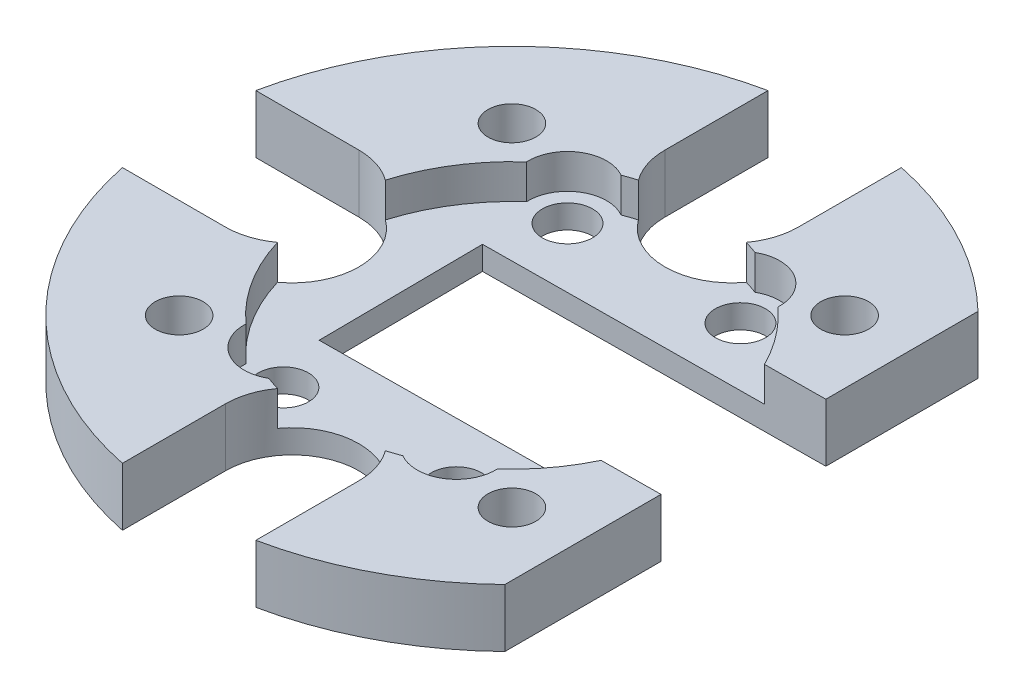
from build123d import *

# Parameters (mm, degrees)
SKETCH_1_R                      = 21
EXTRUDE_1_DEPTH                 = 1.5
SKETCH_2_R                      = 21
SKETCH_2_R_2                    = 12
EXTRUDE_2_DEPTH                 = 2.2
SKETCH_7_R                      = 1.25
CUT_EXTRUDE_5_DEPTH             = 30.92808046
SKETCH_8_W                      = 14.034551426
SKETCH_8_H                      = 10.5
CUT_EXTRUDE_6_DEPTH             = 30.92808046
SKETCH_9_W                      = 17.42220177
SKETCH_9_H                      = 10.5
CUT_EXTRUDE_7_DEPTH             = 30.92808046
MOVE_BODY_5_ANGLE               = 45
MOVE_BODY_6_ANGLE               = 5
SKETCH_15_R                     = 0.55
SKETCH_15_R_2                   = 0.5
CUT_EXTRUDE_9_DEPTH             = 30.92808046
MOVE_BODY_7_ANGLE               = 49.5
SKETCH_16_R                     = 1.35
CUT_EXTRUDE_10_DEPTH            = 1.5
SKETCH_17_R                     = 2.5
CUT_EXTRUDE_11_DEPTH            = 2.2
SKETCH_23_R                     = 2
CUT_EXTRUDE_17_DEPTH            = 30.92808046
CUT_EXTRUDE_18_DEPTH            = 30.779858965
CUT_EXTRUDE_18_DEPTH_BACK       = 30.779858965
SKETCH_24_R                     = 1.6
CUT_EXTRUDE_25_DEPTH            = 30.92808046
SKETCH_42_R                     = 3
CUT_EXTRUDE_26_DEPTH            = 1
HOLE_WIZARD_3_100_1_D           = 3.048
HOLE_WIZARD_3_100_1_CSINK_D     = 5.0546
HOLE_WIZARD_3_100_1_CSINK_ANGLE = 100
CUT_EXTRUDE_27_DEPTH            = 30.92808046


with BuildPart() as part:
    # 草图1 → 凸台-拉伸1 (new body)
    with BuildSketch(Plane(origin=(0, 0, 0), x_dir=(1, 0, 0), z_dir=(0, 1, 0))):
        with Locations(Location((0, 0, 0), (0, 0, 270))):
            Circle(SKETCH_1_R)
    extrude(amount=EXTRUDE_1_DEPTH)

    # 草图2 → 凸台-拉伸2 (add)
    with BuildSketch(Plane(origin=(0, 1.5, 0), x_dir=(1, 0, 0), z_dir=(0, 1, 0))):
        with Locations(Location((0, 0, 0), (0, 0, 270))):
            Circle(SKETCH_2_R)
        with Locations(Location((0, 0, 0), (0, 0, 270))):
            Circle(SKETCH_2_R_2, mode=Mode.SUBTRACT)
    extrude(amount=EXTRUDE_2_DEPTH)

    # 草图7 → 切除-拉伸5 (cut, through all)
    with BuildSketch(Plane.XZ):
        with Locations(Location((-5.51, 9.05, 0), (0, 0, 270))):
            Circle(SKETCH_7_R)
        with Locations(Location((5.51, 9.05, 0), (0, 0, 270))):
            Circle(SKETCH_7_R)
        with Locations(Location((-5.51, -9.05, 0), (0, 0, 270))):
            Circle(SKETCH_7_R)
        with Locations(Location((5.51, -9.05, 0), (0, 0, 270))):
            Circle(SKETCH_7_R)
    extrude(amount=-CUT_EXTRUDE_5_DEPTH, mode=Mode.SUBTRACT)

    # 草图8 → 切除-拉伸6 (cut, through all)
    with BuildSketch(Plane.XZ):
        Rectangle(SKETCH_8_W, SKETCH_8_H)
    extrude(amount=-CUT_EXTRUDE_6_DEPTH, mode=Mode.SUBTRACT)

    # 草图9 → 切除-拉伸7 (cut, through all)
    with BuildSketch(Plane.XZ):
        with Locations((15.728376598, 0)):
            Rectangle(SKETCH_9_W, SKETCH_9_H)
    extrude(amount=-CUT_EXTRUDE_7_DEPTH, mode=Mode.SUBTRACT)


with BuildPart() as part_1:
    # Move Body 5: moved
    add(part.part.rotate(Axis((0, 0, 0), (0, 1, 0)), MOVE_BODY_5_ANGLE))


with BuildPart() as part_2:
    # Move Body 6: moved
    add(part_1.part.rotate(Axis((0, 0, 0), (0, 1, 0)), MOVE_BODY_6_ANGLE))

    # 草图15 → 切除-拉伸9 (cut, through all)
    with BuildSketch(Plane.XZ):
        with Locations(Location((-10.9, 10.9, 0), (0, 0, 270))):
            Circle(SKETCH_15_R)
        with Locations(Location((10.9, 10.9, 0), (0, 0, 270))):
            Circle(SKETCH_15_R_2)
        with Locations(Location((-10.9, -10.9, 0), (0, 0, 270))):
            Circle(SKETCH_15_R_2)
    extrude(amount=-CUT_EXTRUDE_9_DEPTH, mode=Mode.SUBTRACT)


with BuildPart() as part_3:
    # Move Body 7: moved
    add(part_2.part.rotate(Axis((0, 0, 0), (0, -1, 0)), MOVE_BODY_7_ANGLE))

    # 草图16 → 切除-拉伸10 (cut)
    with BuildSketch(Plane.XZ):
        with Locations(Location((-5.51, 9.05, 0), (0, 0, 270))):
            Circle(SKETCH_16_R)
        with Locations(Location((5.51, 9.05, 0), (0, 0, 270))):
            Circle(SKETCH_16_R)
        with Locations(Location((-5.51, -9.05, 0), (0, 0, 270))):
            Circle(SKETCH_16_R)
        with Locations(Location((5.51, -9.05, 0), (0, 0, 270))):
            Circle(SKETCH_16_R)
    extrude(amount=-CUT_EXTRUDE_10_DEPTH, mode=Mode.SUBTRACT)

    # 草图17 → 切除-拉伸11 (cut)
    with BuildSketch(Plane(origin=(0, 3.7, 0), x_dir=(1, 0, 0), z_dir=(0, 1, 0))):
        with Locations((-5.51, 9.05)):
            Circle(SKETCH_17_R)
        with Locations((5.51, 9.05)):
            Circle(SKETCH_17_R)
        with Locations((-5.51, -9.05)):
            Circle(SKETCH_17_R)
        with Locations((5.51, -9.05)):
            Circle(SKETCH_17_R)
    extrude(amount=-CUT_EXTRUDE_11_DEPTH, mode=Mode.SUBTRACT)

    # 草图23 → 切除-拉伸17 (cut, through all)
    with BuildSketch(Plane(origin=(0, 3.7, 0), x_dir=(1, 0, 0), z_dir=(0, 1, 0))):
        with Locations(Location((0, 16, 0), (0, 0, 270))):
            Circle(SKETCH_23_R)
        with Locations(Location((-16, 0, 0), (0, 0, 270))):
            Circle(SKETCH_23_R)
        with Locations(Location((0, -16, 0), (0, 0, 270))):
            Circle(SKETCH_23_R)
    extrude(amount=-CUT_EXTRUDE_17_DEPTH, mode=Mode.SUBTRACT)

    # 草图24 → 切除-拉伸18 (cut, two sides: drawn at the far end of the back side and taken through both)
    with BuildSketch(Plane(origin=(0, 1.5, 0), x_dir=(1, 0, 0), z_dir=(0, 1, 0)).offset(-CUT_EXTRUDE_18_DEPTH_BACK)):
        with Locations(Location((-5.51, 9.05, 0), (0, 0, 270))):
            Circle(SKETCH_24_R)
        with Locations(Location((5.51, 9.05, 0), (0, 0, 270))):
            Circle(SKETCH_24_R)
        with Locations(Location((-5.51, -9.05, 0), (0, 0, 270))):
            Circle(SKETCH_24_R)
        with Locations(Location((5.51, -9.05, 0), (0, 0, 270))):
            Circle(SKETCH_24_R)
    extrude(amount=CUT_EXTRUDE_18_DEPTH + CUT_EXTRUDE_18_DEPTH_BACK, mode=Mode.SUBTRACT)

    # 草图37 → 切除-拉伸25 (cut, through all)
    with BuildSketch(Plane.XZ):
        with BuildLine():
            Line((24.72756624, 20.266700409), (14.622140931, 20.266700409))
            Line((14.622140931, 20.266700409), (14.622140931, 15.072922563))
            ThreePointArc((14.622140931, 15.072922563), (18.200516902, 10.47574267), (20.378202654, 5.072362031))
            Line((20.378202654, 5.072362031), (14.622140931, 5.122594421))
            Line((14.622140931, 5.122594421), (14.622140931, -5.377805402))
            Line((14.622140931, -5.377805402), (20.286574032, -5.427238161))
            ThreePointArc((20.286574032, -5.427238161), (18.108406942, -10.634171243), (14.622140931, -15.072922563))
            Line((14.622140931, -15.072922563), (14.622140931, -20.266073881))
            Line((14.622140931, -20.266073881), (24.72756624, -20.266073881))
            Line((24.72756624, -20.266073881), (24.72756624, 20.266700409))
        make_face()
        with BuildLine():
            ThreePointArc((20.378202654, 5.072362031), (18.200516902, 10.47574267), (14.622140931, 15.072922563))
            Line((14.622140931, 15.072922563), (14.622140931, 5.122594421))
            Line((14.622140931, 5.122594421), (20.378202654, 5.072362031))
        make_face()
        with BuildLine():
            Line((14.622140931, -5.377805402), (14.622140931, -15.072922563))
            ThreePointArc((14.622140931, -15.072922563), (18.108406942, -10.634171243), (20.286574032, -5.427238161))
            Line((20.286574032, -5.427238161), (14.622140931, -5.377805402))
        make_face()
    extrude(amount=-CUT_EXTRUDE_25_DEPTH, mode=Mode.SUBTRACT)

    # 草图42 → 切除-拉伸26 (cut)
    with BuildSketch(Plane(origin=(0, 0, 0), x_dir=(-1, 0, 0), z_dir=(0, -1, 0))):
        with Locations(Location((-10.6, -10.6, 0), (0, 0, 90))):
            Circle(SKETCH_42_R)
        with Locations(Location((-10.6, 10.6, 0), (0, 0, 90))):
            Circle(SKETCH_42_R)
    extrude(amount=-CUT_EXTRUDE_26_DEPTH, mode=Mode.SUBTRACT)

    # #3 平头机械螺钉的锥形沉头孔 (100)1 (through all)
    with Locations(Plane(origin=(0, 0, 0), x_dir=(-1, 0, 0), z_dir=(0, -1, 0))):
        with Locations((10.6, -10.6), (-10.6, -10.6), (10.6, 10.6), (-10.6, 10.6)):
            CounterSinkHole(HOLE_WIZARD_3_100_1_D / 2, HOLE_WIZARD_3_100_1_CSINK_D / 2, counter_sink_angle=HOLE_WIZARD_3_100_1_CSINK_ANGLE)

    # 草图45 → 切除-拉伸27 (cut, through all)
    with BuildSketch(Plane(origin=(0, 3.7, 0), x_dir=(1, 0, 0), z_dir=(0, 1, 0))):
        with BuildLine():
            Line((-33, 4.25), (-14, 4.25))
            ThreePointArc((-14, 4.25), (-9.75, 0), (-14, -4.25))
            Line((-14, -4.25), (-33, -4.25))
            ThreePointArc((-33, -4.25), (-37.25, 0), (-33, 4.25))
        make_face()
        with BuildLine():
            Line((4.25, 33), (4.25, 14))
            ThreePointArc((4.25, 14), (0, 9.75), (-4.25, 14))
            Line((-4.25, 14), (-4.25, 33))
            ThreePointArc((-4.25, 33), (0, 37.25), (4.25, 33))
        make_face()
        with BuildLine():
            Line((-4.25, -33), (-4.25, -14))
            ThreePointArc((-4.25, -14), (0, -9.75), (4.25, -14))
            Line((4.25, -14), (4.25, -33))
            ThreePointArc((4.25, -33), (0, -37.25), (-4.25, -33))
        make_face()
    extrude(amount=-CUT_EXTRUDE_27_DEPTH, mode=Mode.SUBTRACT)


solid = part_3.part
